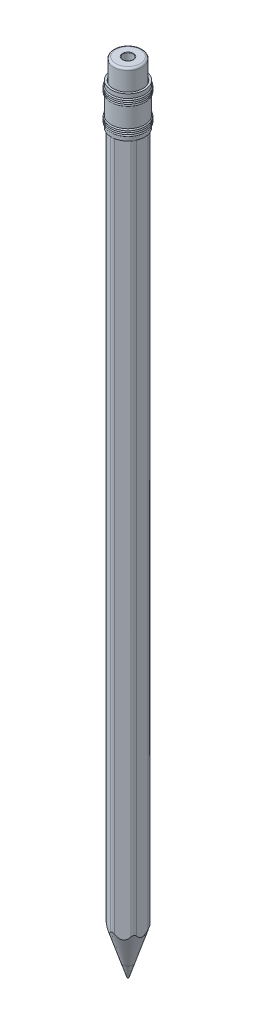
from build123d import *

# Parameters (mm, degrees)
SKETCH1_R           = 1.25
LEAD_DEPTH          = 185
WOODEN_CASING_DEPTH = 185
SKETCH2_4_R         = 1.25
CUT_EXTRUDE6_DEPTH  = 185
SKETCH3_R           = 3.5
ERASER_DEPTH        = 10
FILLET1_R           = 0.5
FILLET2_R           = 1
SKETCH5_W           = 2.170940171
SKETCH5_H           = 0.189957265
SKETCH5_W_2         = 1.546794872
NAME_LABEL_DEPTH    = 0.1
CUT_EXTRUDE4_START  = -2
SKETCH7_R           = 1.25
CUT_EXTRUDE4_DEPTH  = 2
FILLET3_R           = 0.1


with BuildPart() as part:
    # Sketch1 → Lead (new body)
    with BuildSketch(Plane(origin=(0, 0, 0), x_dir=(1, 0, 0), z_dir=(0, 1, 0))):
        with Locations(Location((0, 0, 0), (0, 0, 270))):
            Circle(SKETCH1_R)
    extrude(amount=LEAD_DEPTH)


with BuildPart() as body_2:
    # Sketch2 → Wooden Casing (new body)
    with BuildSketch(Plane(origin=(0, 0, 0), x_dir=(1, 0, 0), z_dir=(0, 1, 0))):
        Polygon((3.5, -2.020725942), (3.5, 2.020725942), (0, 4.041451884), (-3.5, 2.020725942), (-3.5, -2.020725942), (0, -4.041451884), align=None)
    extrude(amount=WOODEN_CASING_DEPTH)

    # Sketch2<4> → Cut-Extrude6 (cut)
    with BuildSketch(Plane(origin=(0, 0, 0), x_dir=(1, 0, 0), z_dir=(0, 1, 0))):
        with Locations(Location((0, 0, 0), (0, 0, 270))):
            Circle(SKETCH2_4_R)
    extrude(amount=CUT_EXTRUDE6_DEPTH, mode=Mode.SUBTRACT)

    # Fillet2
    fillet2_edges = [body_2.edges().sort_by_distance(p)[0] for p in [
        (3.5, 92.5, -2.020725942),
        (0, 92.5, -4.041451884),
        (-3.5, 92.5, -2.020725942),
        (-3.5, 92.5, 2.020725942),
        (0, 92.5, 4.041451884),
        (3.5, 92.5, 2.020725942),
    ]]
    fillet(fillet2_edges, radius=FILLET2_R)

    # Sketch5 → Name_Label (cut)
    # profile 1 of 9: a face of its own
    with BuildSketch(Plane(origin=(-1.75, 0, -3.031088913), x_dir=(-0.8660254037844386, 0, 0.5000000000000001), z_dir=(-0.5000000000000001, 0, -0.8660254037844386))):
        with BuildLine():
            Line((-1.173290994, 169.326265828), (-1.173290994, 169.739253275))
            add(Edge.make_bspline(
                [(-1.173290994, 169.739253275), (-1.17318638, 169.759469864), (-1.172983612, 169.798654645), (-1.169765835, 169.855630641), (-1.165488106, 169.909015169), (-1.158312444, 169.958713893), (-1.15087223, 170.005050195), (-1.139951776, 170.047553663), (-1.127889737, 170.086580317), (-1.109330654, 170.13344334), (-1.080508163, 170.186615862), (-1.037761669, 170.243766373), (-0.986512076, 170.293445085), (-0.928109122, 170.335686715), (-0.863859254, 170.369586522), (-0.795144829, 170.39380127), (-0.723121885, 170.409357747), (-0.673743498, 170.410937521), (-0.648788456, 170.411735914)],
                knots=[0, 0, 0, 0, 1.00128172, 1.940733171, 2.826250472, 3.653024905, 4.427672124, 5.149348099, 5.824709082, 6.450061444, 7.643590664, 8.808605388, 9.972104426, 11.165284501, 12.367876273, 13.557044126, 14.765369432, 16, 16, 16, 16], degree=3))
            add(Edge.make_bspline(
                [(-0.648788456, 170.411735914), (-0.625413891, 170.411070911), (-0.579480666, 170.409764118), (-0.512413876, 170.397420341), (-0.44863728, 170.377829002), (-0.388205461, 170.350752981), (-0.332243361, 170.315867044), (-0.280924337, 170.274068787), (-0.236187965, 170.223848516), (-0.211187221, 170.186203231), (-0.198487976, 170.167081133)],
                knots=[0, 0, 0, 0, 1.044641374, 2.052818814, 3.038628718, 4.023282556, 5.005660861, 5.98021751, 6.974042014, 8, 8, 8, 8], degree=3))
            add(Edge.make_bspline(
                [(-0.198487976, 170.167081133), (-0.189253296, 170.191124403), (-0.171585068, 170.237125134), (-0.140396688, 170.30046537), (-0.10635159, 170.354837993), (-0.06974703, 170.401305145), (-0.029709295, 170.440836663), (0.014086903, 170.475073244), (0.061605709, 170.504671435), (0.112672477, 170.529859292), (0.16685429, 170.549644667), (0.223489372, 170.564186643), (0.282360611, 170.572788538), (0.322311813, 170.573961969), (0.34255102, 170.574556426)],
                knots=[0, 0, 0, 0, 1.272586185, 2.434772614, 3.483318042, 4.437947805, 5.351807173, 6.25737843, 7.180033415, 8.1141739, 9.066731021, 10.025721652, 10.999834114, 12, 12, 12, 12], degree=3))
            add(Edge.make_bspline(
                [(0.34255102, 170.574556426), (0.363213927, 170.573965796), (0.403868775, 170.572803715), (0.463590917, 170.564226364), (0.520669704, 170.549713349), (0.575448027, 170.52968824), (0.627811035, 170.503732367), (0.677569036, 170.471688388), (0.72482555, 170.434006137), (0.769663978, 170.391419102), (0.81069255, 170.343959184), (0.845963285, 170.291655299), (0.876291091, 170.235940319), (0.900982909, 170.176101982), (0.92003263, 170.112293042), (0.933305046, 170.044549006), (0.942262985, 169.972981439), (0.942998484, 169.923868515), (0.943375673, 169.898681693)],
                knots=[0, 0, 0, 0, 0.978680899, 1.925582087, 2.851223405, 3.764209995, 4.683484765, 5.614004905, 6.562443559, 7.542772147, 8.539900013, 9.527881485, 10.525548727, 11.540192123, 12.58875426, 13.674701727, 14.807505862, 16, 16, 16, 16], degree=3))
            Line((0.943375673, 169.898681693), (0.943375673, 169.326265828))
            Line((0.943375673, 169.326265828), (-1.173290994, 169.326265828))
        make_face()
        with BuildLine():
            Line((-0.956196977, 169.516223093), (-0.277778173, 169.516223093))
            Line((-0.277778173, 169.516223093), (-0.277778173, 169.64385063))
            add(Edge.make_bspline(
                [(-0.277778173, 169.64385063), (-0.278020031, 169.662506807), (-0.278487351, 169.698554341), (-0.279826002, 169.750757326), (-0.283574341, 169.799213886), (-0.287321609, 169.84384037), (-0.293414319, 169.884566534), (-0.300666755, 169.921302042), (-0.308336709, 169.954623787), (-0.321381886, 169.993049184), (-0.340655044, 170.036642262), (-0.37059445, 170.083083883), (-0.406226123, 170.124216048), (-0.447724715, 170.158533324), (-0.492923978, 170.186867359), (-0.541427106, 170.206716242), (-0.592258036, 170.219948901), (-0.627220917, 170.221162485), (-0.644972351, 170.221778649)],
                knots=[0, 0, 0, 0, 1.156917035, 2.235399477, 3.236897345, 4.169954739, 5.01148057, 5.788325709, 6.491867502, 7.129259015, 8.302032419, 9.437271567, 10.542795419, 11.662606952, 12.764338259, 13.836858145, 14.901724648, 16, 16, 16, 16], degree=3))
            add(Edge.make_bspline(
                [(-0.644972351, 170.221778649), (-0.656721857, 170.221465799), (-0.679769797, 170.220852109), (-0.713477528, 170.215643402), (-0.745150432, 170.207203913), (-0.775092488, 170.19577457), (-0.802559565, 170.180160392), (-0.828864111, 170.162061508), (-0.852430611, 170.139715866), (-0.87439365, 170.114463307), (-0.894050496, 170.085569875), (-0.910333147, 170.052413061), (-0.925090639, 170.015850019), (-0.936015171, 169.974888774), (-0.945621584, 169.930378057), (-0.951657358, 169.881715175), (-0.955541435, 169.829208497), (-0.955973589, 169.792827964), (-0.956196977, 169.774022238)],
                knots=[0, 0, 0, 0, 0.911708768, 1.788416306, 2.640049961, 3.452993646, 4.268229297, 5.087074648, 5.92553149, 6.781184137, 7.681934069, 8.628939405, 9.643570426, 10.73771997, 11.914765019, 13.176320755, 14.540391495, 16, 16, 16, 16], degree=3))
            Line((-0.956196977, 169.774022238), (-0.956196977, 169.516223093))
        make_face(mode=Mode.SUBTRACT)
        with BuildLine():
            Line((-0.060684156, 169.516223093), (0.726281656, 169.516223093))
            Line((0.726281656, 169.516223093), (0.726281656, 169.786742591))
            add(Edge.make_bspline(
                [(0.726281656, 169.786742591), (0.726026504, 169.806104392), (0.725534732, 169.843421712), (0.724381425, 169.897343941), (0.72001864, 169.947191093), (0.71599399, 169.99312042), (0.709112012, 170.035010023), (0.702617214, 170.07318212), (0.692976151, 170.10701009), (0.679725643, 170.146596642), (0.658513226, 170.190845256), (0.627522083, 170.239201028), (0.58927423, 170.281366511), (0.54577454, 170.317561641), (0.498607602, 170.347431435), (0.448390033, 170.368865838), (0.396098469, 170.38218594), (0.360436102, 170.383793135), (0.34255102, 170.384599161)],
                knots=[0, 0, 0, 0, 1.160376723, 2.23647316, 3.230273494, 4.158083346, 4.997711197, 5.773399541, 6.476071462, 7.102777513, 8.27340052, 9.405620712, 10.53304798, 11.669441455, 12.787990954, 13.865552736, 14.929550474, 16, 16, 16, 16], degree=3))
            add(Edge.make_bspline(
                [(0.34255102, 170.384599161), (0.331366711, 170.384432695), (0.309178498, 170.384102448), (0.276575776, 170.379099288), (0.244978583, 170.371861301), (0.214255248, 170.362328663), (0.184922344, 170.34900255), (0.156867378, 170.332665851), (0.129525192, 170.313965597), (0.094511155, 170.285114643), (0.054670038, 170.242537994), (0.016144949, 170.182031825), (-0.015425989, 170.113614028), (-0.02877283, 170.063875301), (-0.035667463, 170.03818156)],
                knots=[0, 0, 0, 0, 0.723302347, 1.434937762, 2.129609326, 2.821140842, 3.513216847, 4.209993937, 4.920569932, 5.655069131, 7.14393391, 8.6716197, 10.280644748, 12, 12, 12, 12], degree=3))
            add(Edge.make_bspline(
                [(-0.035667463, 170.03818156), (-0.037756966, 170.027883011), (-0.04228744, 170.005553634), (-0.047069717, 169.969142383), (-0.051330301, 169.927573548), (-0.054481811, 169.880751141), (-0.057739387, 169.828615923), (-0.059006255, 169.771056549), (-0.060517713, 169.708308077), (-0.060627256, 169.664769833), (-0.060684156, 169.642154583)],
                knots=[0, 0, 0, 0, 0.634451884, 1.375622551, 2.216452059, 3.157844607, 4.20941857, 5.370758133, 6.634282058, 8, 8, 8, 8], degree=3))
            Line((-0.060684156, 169.642154583), (-0.060684156, 169.516223093))
        make_face(mode=Mode.SUBTRACT)
    # profile 2 of 9: a face of its own
    with BuildSketch(Plane(origin=(-1.75, 0, -3.031088913), x_dir=(-0.8660254037844386, 0, 0.5000000000000001), z_dir=(-0.5000000000000001, 0, -0.8660254037844386))):
        Polygon((-1.173290994, 167.31814617), (-1.173290994, 167.508103435), (-0.304914925, 167.508103435), (-0.304914925, 168.59357352), (-1.173290994, 168.59357352), (-1.173290994, 168.783530785), (0.943375673, 168.783530785), (0.943375673, 168.59357352), (-0.087820908, 168.59357352), (-0.087820908, 167.508103435), (0.943375673, 167.508103435), (0.943375673, 167.31814617), align=None)
    # profile 3 of 9: a face of its own
    with BuildSketch(Plane(origin=(-1.75, 0, -3.031088913), x_dir=(-0.8660254037844386, 0, 0.5000000000000001), z_dir=(-0.5000000000000001, 0, -0.8660254037844386))):
        with Locations((-0.142094412, 165.920603435)):
            Rectangle(SKETCH5_W, SKETCH5_H)
    # profile 4 of 9: a face of its own
    with BuildSketch(Plane(origin=(-1.75, 0, -3.031088913), x_dir=(-0.8660254037844386, 0, 0.5000000000000001), z_dir=(-0.5000000000000001, 0, -0.8660254037844386))):
        with BuildLine():
            add(Edge.make_bspline(
                [(-1.25470125, 165.322746864), (-1.254154453, 165.33453447), (-1.25308372, 165.357616865), (-1.243914636, 165.39099565), (-1.228372445, 165.421389177), (-1.207520448, 165.448348091), (-1.182997689, 165.471481375), (-1.154416056, 165.487677329), (-1.123537736, 165.49808673), (-1.101999087, 165.499343761), (-1.091032714, 165.499983777)],
                knots=[0, 0, 0, 0, 1.055194115, 2.066272739, 3.074728998, 4.095836921, 5.109056067, 6.073838105, 7.019297344, 8, 8, 8, 8], degree=3))
            add(Edge.make_bspline(
                [(-1.091032714, 165.499983777), (-1.080351014, 165.499329328), (-1.059234558, 165.498035559), (-1.028891553, 165.487685369), (-1.000707058, 165.471343349), (-0.976231914, 165.448362925), (-0.955391444, 165.421385246), (-0.939846197, 165.390996695), (-0.930677924, 165.35761659), (-0.929607078, 165.334534377), (-0.929060224, 165.322746864)],
                knots=[0, 0, 0, 0, 0.96129708, 1.900370562, 2.859976407, 3.87933698, 4.906634145, 5.921202961, 6.938410037, 8, 8, 8, 8], degree=3))
            add(Edge.make_bspline(
                [(-0.929060224, 165.322746864), (-0.929586198, 165.311094146), (-0.930609937, 165.288413651), (-0.940026091, 165.255534656), (-0.955396763, 165.225400284), (-0.976095456, 165.198388791), (-1.00085737, 165.175873389), (-1.028874353, 165.159485354), (-1.059238937, 165.149159067), (-1.080352485, 165.147862078), (-1.091032714, 165.147205999)],
                knots=[0, 0, 0, 0, 1.054934014, 2.053291228, 3.073705704, 4.106921865, 5.123545215, 6.088680038, 7.033164197, 8, 8, 8, 8], degree=3))
            add(Edge.make_bspline(
                [(-1.091032714, 165.147205999), (-1.101997561, 165.147847704), (-1.123533213, 165.149108052), (-1.154433542, 165.159493094), (-1.182846164, 165.175736883), (-1.207656824, 165.1984037), (-1.228367158, 165.225396316), (-1.243734752, 165.255535681), (-1.253151704, 165.28841338), (-1.254175333, 165.311094054), (-1.25470125, 165.322746864)],
                knots=[0, 0, 0, 0, 0.98631895, 1.937192651, 2.907499808, 3.917963147, 4.944918757, 5.95915025, 6.951458133, 8, 8, 8, 8], degree=3))
        make_face()
    # profile 5 of 9: a face of its own
    with BuildSketch(Plane(origin=(-1.75, 0, -3.031088913), x_dir=(-0.8660254037844386, 0, 0.5000000000000001), z_dir=(-0.5000000000000001, 0, -0.8660254037844386))):
        with Locations((0.169978237, 165.323594888)):
            Rectangle(SKETCH5_W_2, SKETCH5_H)
    # profile 6 of 9: a face of its own
    with BuildSketch(Plane(origin=(-1.75, 0, -3.031088913), x_dir=(-0.8660254037844386, 0, 0.5000000000000001), z_dir=(-0.5000000000000001, 0, -0.8660254037844386))):
        with BuildLine():
            Line((-0.268025903, 164.875838478), (-0.169231165, 164.716834071))
            add(Edge.make_bspline(
                [(-0.169231165, 164.716834071), (-0.190898812, 164.699398866), (-0.233547898, 164.665080627), (-0.288587239, 164.605487851), (-0.335859688, 164.541980948), (-0.37438529, 164.4734747), (-0.404152548, 164.400065192), (-0.425216529, 164.322041925), (-0.438342428, 164.239416024), (-0.439834277, 164.18277088), (-0.440598686, 164.153746464)],
                knots=[0, 0, 0, 0, 1.026593902, 2.0206758, 2.988051866, 3.946915611, 4.916868779, 5.907761954, 6.927957743, 8, 8, 8, 8], degree=3))
            add(Edge.make_bspline(
                [(-0.440598686, 164.153746464), (-0.439959548, 164.130548428), (-0.438700783, 164.084860527), (-0.430832533, 164.01778871), (-0.416534747, 163.95390024), (-0.397695835, 163.892794668), (-0.37244685, 163.834906606), (-0.341719045, 163.780084383), (-0.30600783, 163.72784173), (-0.264635738, 163.679692558), (-0.219642258, 163.635648349), (-0.171410262, 163.597488529), (-0.121384423, 163.564264765), (-0.068315512, 163.538195925), (-0.013417613, 163.516862845), (0.044345528, 163.502828305), (0.104233895, 163.493475846), (0.145066414, 163.492405824), (0.16573812, 163.491864119)],
                knots=[0, 0, 0, 0, 1.112346261, 2.190735716, 3.231507886, 4.247384806, 5.251966152, 6.253067467, 7.256802811, 8.280671706, 9.291813951, 10.270744147, 11.225547591, 12.165006084, 13.100104208, 14.043489273, 15.009504848, 16, 16, 16, 16], degree=3))
            add(Edge.make_bspline(
                [(0.16573812, 163.491864119), (0.192808964, 163.492956451), (0.246724424, 163.495131986), (0.326175482, 163.511678619), (0.402849842, 163.539365495), (0.47633299, 163.57676918), (0.54441973, 163.62424699), (0.605492244, 163.679984719), (0.658357708, 163.744041809), (0.702186446, 163.815846252), (0.73742067, 163.893714126), (0.762522733, 163.976802401), (0.777673451, 164.064432275), (0.779582045, 164.124428736), (0.78055516, 164.155018499)],
                knots=[0, 0, 0, 0, 0.96628757, 1.924499989, 2.884001032, 3.87047137, 4.860396324, 5.839257425, 6.814467993, 7.816059692, 8.834901047, 9.858382822, 10.908076205, 12, 12, 12, 12], degree=3))
            add(Edge.make_bspline(
                [(0.78055516, 164.155018499), (0.779769274, 164.183052349), (0.778224798, 164.238146302), (0.765204902, 164.318680803), (0.743890895, 164.395352464), (0.714168268, 164.468158558), (0.675749247, 164.536966049), (0.628360605, 164.60133036), (0.573365614, 164.662532227), (0.530839983, 164.698513732), (0.509187639, 164.716834071)],
                knots=[0, 0, 0, 0, 1.039848629, 2.043578496, 3.018386758, 3.987534228, 4.954977003, 5.934852016, 6.948509513, 8, 8, 8, 8], degree=3))
            Line((0.509187639, 164.716834071), (0.61349453, 164.875838478))
            add(Edge.make_bspline(
                [(0.61349453, 164.875838478), (0.627337969, 164.866411629), (0.654978901, 164.847589221), (0.693952247, 164.816124895), (0.730432503, 164.782185759), (0.764370767, 164.745904219), (0.796579188, 164.707754018), (0.825517998, 164.666431901), (0.852813819, 164.623270279), (0.877374937, 164.577762455), (0.89945257, 164.530378938), (0.918436754, 164.481186401), (0.934747246, 164.43039861), (0.947711737, 164.377955849), (0.95805972, 164.32375473), (0.964926007, 164.267935427), (0.970051534, 164.210517166), (0.970357463, 164.171708293), (0.970512425, 164.152050417)],
                knots=[0, 0, 0, 0, 0.954134338, 1.905101784, 2.851144739, 3.791306361, 4.734911809, 5.6936923, 6.663572882, 7.643865596, 8.638447847, 9.640600242, 10.646758161, 11.676244097, 12.717260333, 13.78922464, 14.880174919, 16, 16, 16, 16], degree=3))
            add(Edge.make_bspline(
                [(0.970512425, 164.152050417), (0.969972518, 164.122048037), (0.968914295, 164.063243154), (0.957310374, 163.977166386), (0.939752034, 163.89493061), (0.914764782, 163.816391309), (0.881766248, 163.742028643), (0.842381322, 163.671223539), (0.795308446, 163.60470666), (0.741665914, 163.542914069), (0.683445631, 163.486404764), (0.620984012, 163.437232782), (0.555661275, 163.395561063), (0.487065678, 163.361233263), (0.415478492, 163.334392126), (0.340462387, 163.315912959), (0.262653836, 163.303989573), (0.209596959, 163.302607518), (0.18269859, 163.301906854)],
                knots=[0, 0, 0, 0, 1.113096611, 2.181677437, 3.217994567, 4.231807234, 5.234933164, 6.233258928, 7.234764453, 8.254006763, 9.267004511, 10.242118657, 11.199842941, 12.138404996, 13.084707599, 14.031460992, 15.002005182, 16, 16, 16, 16], degree=3))
            add(Edge.make_bspline(
                [(0.18269859, 163.301906854), (0.164447822, 163.302173563), (0.128144033, 163.302704093), (0.074262731, 163.308789164), (0.021098992, 163.316650145), (-0.030673296, 163.329970472), (-0.081839352, 163.345355997), (-0.131782466, 163.364995961), (-0.18073472, 163.388034605), (-0.228570014, 163.414191735), (-0.274501402, 163.443636833), (-0.317895285, 163.47622215), (-0.359272953, 163.510720392), (-0.397205894, 163.548745469), (-0.433211114, 163.588683736), (-0.466326742, 163.631665117), (-0.496650103, 163.677443085), (-0.524741908, 163.725330142), (-0.549754518, 163.775298419), (-0.571304143, 163.827045882), (-0.589720701, 163.880260714), (-0.604300857, 163.935028039), (-0.616527584, 163.990984344), (-0.624218853, 164.048570582), (-0.629653409, 164.107566449), (-0.630252602, 164.147514616), (-0.630555951, 164.167738852)],
                knots=[0, 0, 0, 0, 0.990994727, 1.971252077, 2.943264845, 3.907940874, 4.872158414, 5.844625996, 6.82015047, 7.809835459, 8.804511986, 9.781214284, 10.756496977, 11.728388426, 12.696359165, 13.676225489, 14.672885716, 15.677705647, 16.690706858, 17.706033469, 18.721040654, 19.747369689, 20.783475414, 21.830280724, 22.901553713, 24, 24, 24, 24], degree=3))
            add(Edge.make_bspline(
                [(-0.630555951, 164.167738852), (-0.629998484, 164.193066377), (-0.628886337, 164.243594829), (-0.61952458, 164.318548979), (-0.605414829, 164.392401355), (-0.584494532, 164.463845696), (-0.559219998, 164.53205395), (-0.530666918, 164.595732687), (-0.498212122, 164.653920229), (-0.462054308, 164.707129825), (-0.420864787, 164.75534673), (-0.375062815, 164.799806758), (-0.32431871, 164.840802839), (-0.286945032, 164.864063549), (-0.268025903, 164.875838478)],
                knots=[0, 0, 0, 0, 1.095139042, 2.184804066, 3.262657822, 4.34424993, 5.400369085, 6.407210964, 7.359649996, 8.278719237, 9.185177137, 10.097389079, 11.036869154, 12, 12, 12, 12], degree=3))
        make_face()
    # profile 7 of 9: a face of its own
    with BuildSketch(Plane(origin=(-1.75, 0, -3.031088913), x_dir=(-0.8660254037844386, 0, 0.5000000000000001), z_dir=(-0.5000000000000001, 0, -0.8660254037844386))):
        with BuildLine():
            Line((-0.603419199, 161.565154717), (-0.603419199, 161.755111982))
            Line((-0.603419199, 161.755111982), (-0.324419466, 161.755111982))
            add(Edge.make_bspline(
                [(-0.324419466, 161.755111982), (-0.349762188, 161.775359254), (-0.398863381, 161.81458808), (-0.46289085, 161.88058976), (-0.516620138, 161.949409876), (-0.558924228, 162.022166174), (-0.590918916, 162.098109976), (-0.613990856, 162.177025794), (-0.627833243, 162.259340761), (-0.629641277, 162.315320482), (-0.630555951, 162.343640294)],
                knots=[0, 0, 0, 0, 1.127869841, 2.185233117, 3.191641716, 4.159226741, 5.10472073, 6.052603964, 7.014823782, 8, 8, 8, 8], degree=3))
            add(Edge.make_bspline(
                [(-0.630555951, 162.343640294), (-0.629561726, 162.372278498), (-0.627614813, 162.428358468), (-0.610410434, 162.509703554), (-0.583343217, 162.586142264), (-0.54491073, 162.656547904), (-0.497448, 162.720165207), (-0.442070067, 162.775836747), (-0.378706573, 162.822259164), (-0.31957811, 162.8532884), (-0.267033951, 162.873339725), (-0.222095045, 162.886519605), (-0.172006279, 162.897181554), (-0.116892771, 162.906735358), (-0.056532768, 162.913108724), (0.008929549, 162.918160825), (0.079482882, 162.921774446), (0.128279006, 162.921918196), (0.153441779, 162.921992324)],
                knots=[0, 0, 0, 0, 1.235846195, 2.420061613, 3.574938557, 4.72781258, 5.870749808, 6.993217613, 8.10690044, 9.251157787, 9.865716151, 10.534141144, 11.271861846, 12.076851687, 12.949307443, 13.892392281, 14.913166647, 16, 16, 16, 16], degree=3))
            Line((0.153441779, 162.921992324), (0.943375673, 162.921992324))
            Line((0.943375673, 162.921992324), (0.943375673, 162.732035059))
            Line((0.943375673, 162.732035059), (0.215771506, 162.732035059))
            add(Edge.make_bspline(
                [(0.215771506, 162.732035059), (0.194712188, 162.731918698), (0.154429296, 162.731696118), (0.096754136, 162.730984904), (0.044590127, 162.72931074), (-0.002212648, 162.72686151), (-0.043482886, 162.723433207), (-0.07942949, 162.719763146), (-0.109734052, 162.715311902), (-0.127976721, 162.7113426), (-0.136158248, 162.709562436)],
                knots=[0, 0, 0, 0, 1.430803381, 2.736883362, 3.918614142, 4.976458302, 5.92063272, 6.731858525, 7.431260095, 8, 8, 8, 8], degree=3))
            add(Edge.make_bspline(
                [(-0.136158248, 162.709562436), (-0.160191313, 162.703168416), (-0.206324508, 162.690894637), (-0.268793601, 162.65994896), (-0.322409558, 162.621777799), (-0.366069699, 162.574484605), (-0.400057995, 162.519339558), (-0.423622777, 162.456250983), (-0.438366118, 162.385871815), (-0.439833737, 162.336369083), (-0.440598686, 162.310567377)],
                knots=[0, 0, 0, 0, 1.084232, 2.08126119, 3.027460722, 3.945137793, 4.874029258, 5.839697328, 6.874011781, 8, 8, 8, 8], degree=3))
            add(Edge.make_bspline(
                [(-0.440598686, 162.310567377), (-0.440314957, 162.295285087), (-0.439753466, 162.265041828), (-0.4339773, 162.220218554), (-0.424846158, 162.176606623), (-0.411389424, 162.134305322), (-0.394872474, 162.093177361), (-0.375002014, 162.052934071), (-0.350540889, 162.01450415), (-0.323194572, 161.977255213), (-0.292913078, 161.942592876), (-0.260953566, 161.910342378), (-0.226920529, 161.881593077), (-0.191360481, 161.855546813), (-0.153785533, 161.833062808), (-0.114558066, 161.813436419), (-0.073626482, 161.796783879), (-0.045217755, 161.788509108), (-0.031003333, 161.784368793)],
                knots=[0, 0, 0, 0, 1.023827899, 2.026128959, 3.023898047, 4.006668367, 4.997079741, 5.992687789, 7.009920206, 8.046337072, 9.087246971, 10.092051999, 11.086713115, 12.070168086, 13.043348831, 14.017773728, 15.008185103, 16, 16, 16, 16], degree=3))
            add(Edge.make_bspline(
                [(-0.031003333, 161.784368793), (-0.020568044, 161.781986243), (0.002149035, 161.776799558), (0.039429232, 161.77119754), (0.082554788, 161.766112958), (0.13147538, 161.761857274), (0.186362285, 161.759253522), (0.246981101, 161.75641453), (0.313573544, 161.755380955), (0.359935616, 161.75520415), (0.384104172, 161.755111982)],
                knots=[0, 0, 0, 0, 0.615963638, 1.340920617, 2.168419149, 3.115676021, 4.16674242, 5.331190069, 6.6087489, 8, 8, 8, 8], degree=3))
            Line((0.384104172, 161.755111982), (0.943375673, 161.755111982))
            Line((0.943375673, 161.755111982), (0.943375673, 161.565154717))
            Line((0.943375673, 161.565154717), (-0.603419199, 161.565154717))
        make_face()
    # profile 8 of 9: a face of its own
    with BuildSketch(Plane(origin=(-1.75, 0, -3.031088913), x_dir=(-0.8660254037844386, 0, 0.5000000000000001), z_dir=(-0.5000000000000001, 0, -0.8660254037844386))):
        with BuildLine():
            Line((0.454914135, 160.935073253), (0.543532591, 161.103829931))
            add(Edge.make_bspline(
                [(0.543532591, 161.103829931), (0.56738076, 161.09037503), (0.613779854, 161.064197121), (0.677530207, 161.019361935), (0.734539621, 160.971931386), (0.783895211, 160.920462351), (0.827482326, 160.86650581), (0.86507865, 160.809036961), (0.897362557, 160.748524887), (0.923816206, 160.684303077), (0.944612927, 160.616448463), (0.959971447, 160.544567304), (0.96887793, 160.468320203), (0.969958909, 160.416106293), (0.970512425, 160.389370128)],
                knots=[0, 0, 0, 0, 1.120611642, 2.180266485, 3.186550691, 4.152466804, 5.095166165, 6.022949561, 6.960161436, 7.899497276, 8.862391909, 9.862399089, 10.905440174, 12, 12, 12, 12], degree=3))
            add(Edge.make_bspline(
                [(0.970512425, 160.389370128), (0.969818657, 160.359650932), (0.968465317, 160.301677391), (0.95679797, 160.217289067), (0.937764685, 160.137835802), (0.911176004, 160.063322049), (0.876446133, 159.993930338), (0.834137352, 159.929522559), (0.784466711, 159.869760723), (0.727005075, 159.816525332), (0.665509145, 159.768607968), (0.6014403, 159.72629666), (0.535020419, 159.691087586), (0.466644684, 159.662009437), (0.396468473, 159.639072287), (0.324089878, 159.622772795), (0.249795901, 159.613463605), (0.199542843, 159.612030674), (0.174218355, 159.611308563)],
                knots=[0, 0, 0, 0, 1.14524686, 2.234044844, 3.276713788, 4.290115724, 5.276966211, 6.260758605, 7.254862358, 8.264742877, 9.274005885, 10.257798278, 11.220590477, 12.167824544, 13.118936889, 14.062732937, 15.023735098, 16, 16, 16, 16], degree=3))
            add(Edge.make_bspline(
                [(0.174218355, 159.611308563), (0.150454338, 159.611949091), (0.103357196, 159.613218534), (0.033648985, 159.62122001), (-0.034101555, 159.635400645), (-0.099950721, 159.65485966), (-0.163788259, 159.67998827), (-0.225653022, 159.71072966), (-0.285479178, 159.747131717), (-0.323218216, 159.77523662), (-0.34222796, 159.789393499)],
                knots=[0, 0, 0, 0, 1.024358464, 2.0301432, 3.019427413, 4.004406732, 4.986367066, 5.972626655, 6.978780325, 8, 8, 8, 8], degree=3))
            add(Edge.make_bspline(
                [(-0.34222796, 159.789393499), (-0.365167582, 159.808536039), (-0.410246472, 159.846153244), (-0.468938508, 159.910437475), (-0.519144528, 159.979108056), (-0.560102698, 160.052855731), (-0.591606006, 160.131556276), (-0.614013893, 160.214803759), (-0.627957104, 160.302828274), (-0.629676498, 160.363170043), (-0.630555951, 160.394034258)],
                knots=[0, 0, 0, 0, 1.030811313, 2.025658015, 2.997072178, 3.962767568, 4.930766827, 5.917075773, 6.934604948, 8, 8, 8, 8], degree=3))
            add(Edge.make_bspline(
                [(-0.630555951, 160.394034258), (-0.629741175, 160.425754395), (-0.62814277, 160.487982074), (-0.613191755, 160.578690017), (-0.589770091, 160.664688312), (-0.555645838, 160.745267261), (-0.513346496, 160.821668466), (-0.459882109, 160.892133562), (-0.39799867, 160.958596862), (-0.350358063, 160.997242288), (-0.326115513, 161.016907521)],
                knots=[0, 0, 0, 0, 1.056389096, 2.072394598, 3.055233004, 4.020130009, 4.981825462, 5.957811105, 6.960805292, 8, 8, 8, 8], degree=3))
            add(Edge.make_bspline(
                [(-0.326115513, 161.016907521), (-0.307849538, 161.030289051), (-0.27143917, 161.056963038), (-0.212068995, 161.09037438), (-0.14995354, 161.119377185), (-0.084088741, 161.1425595), (-0.015254995, 161.161331007), (0.057039782, 161.174912036), (0.132774062, 161.18287652), (0.184376312, 161.184442065), (0.210683365, 161.185240187)],
                knots=[0, 0, 0, 0, 0.94817472, 1.890038105, 2.849395472, 3.817997239, 4.812318967, 5.836947057, 6.897266129, 8, 8, 8, 8], degree=3))
            Line((0.210683365, 161.185240187), (0.210683365, 159.801265828))
            add(Edge.make_bspline(
                [(0.210683365, 159.801265828), (0.231064122, 159.802196923), (0.271142059, 159.804027885), (0.329786294, 159.812564186), (0.385650173, 159.826019396), (0.438314679, 159.844929734), (0.488467661, 159.86783016), (0.535737083, 159.895882474), (0.579907641, 159.929349728), (0.621374434, 159.96667908), (0.658301656, 160.008230514), (0.691352968, 160.051944366), (0.719054448, 160.098446664), (0.741539429, 160.147370743), (0.75914182, 160.19863749), (0.771157121, 160.252263055), (0.779204753, 160.308141916), (0.780099598, 160.346233289), (0.78055516, 160.36562547)],
                knots=[0, 0, 0, 0, 1.094153842, 2.151609401, 3.174256925, 4.172055639, 5.149267565, 6.128595816, 7.11444997, 8.118368179, 9.117203808, 10.09244225, 11.054858984, 12.015122123, 12.976791628, 13.957293641, 14.960065497, 16, 16, 16, 16], degree=3))
            add(Edge.make_bspline(
                [(0.78055516, 160.36562547), (0.780190392, 160.384586277), (0.779466622, 160.422208156), (0.772327988, 160.478221631), (0.761013874, 160.533424793), (0.744718108, 160.587269491), (0.725635985, 160.638971006), (0.703176451, 160.687113935), (0.677570039, 160.731061805), (0.64847156, 160.772297094), (0.612760083, 160.812076763), (0.568623819, 160.85216311), (0.515562174, 160.894197524), (0.475890895, 160.920935279), (0.454914135, 160.935073253)],
                knots=[0, 0, 0, 0, 0.991168677, 1.966668791, 2.94808785, 3.9350306, 4.905702032, 5.828266021, 6.709360349, 7.562606342, 8.463112863, 9.498839253, 10.677475166, 12, 12, 12, 12], degree=3))
        make_face()
        with BuildLine():
            add(Edge.make_bspline(
                [(0.0207261, 160.995282922), (-0.00448261, 160.988358357), (-0.052875143, 160.975065442), (-0.119863688, 160.946755869), (-0.179742238, 160.915642049), (-0.231515746, 160.878187132), (-0.277571164, 160.836164151), (-0.317174949, 160.786954225), (-0.353676999, 160.732691645), (-0.384074516, 160.672295608), (-0.409053959, 160.608147835), (-0.427421571, 160.541566815), (-0.438218603, 160.473110224), (-0.439801596, 160.427003051), (-0.440598686, 160.403786528)],
                knots=[0, 0, 0, 0, 1.155085888, 2.217389643, 3.210301801, 4.133263417, 5.03575695, 5.95948047, 6.920061569, 7.923798377, 8.943125483, 9.960783337, 10.973185325, 12, 12, 12, 12], degree=3))
            add(Edge.make_bspline(
                [(-0.440598686, 160.403786528), (-0.440233084, 160.384826133), (-0.439510366, 160.347345418), (-0.432511344, 160.292150943), (-0.421264693, 160.239007289), (-0.404728225, 160.188073089), (-0.384606612, 160.139010477), (-0.359873078, 160.091854905), (-0.329969802, 160.047212566), (-0.307126846, 160.019311167), (-0.295586667, 160.005215481)],
                knots=[0, 0, 0, 0, 1.048823158, 2.073302879, 3.073550078, 4.050623576, 5.03253758, 6.005186856, 6.992227572, 8, 8, 8, 8], degree=3))
            add(Edge.make_bspline(
                [(-0.295586667, 160.005215481), (-0.286459159, 159.995118438), (-0.267987308, 159.974684483), (-0.236144194, 159.94740991), (-0.201787338, 159.921100717), (-0.163417032, 159.897721166), (-0.122145973, 159.875502373), (-0.077673017, 159.855255291), (-0.029810442, 159.836845708), (0.003558332, 159.826511293), (0.0207261, 159.82119438)],
                knots=[0, 0, 0, 0, 0.879905587, 1.780714457, 2.708106151, 3.677566983, 4.684151534, 5.740052498, 6.837288539, 8, 8, 8, 8], degree=3))
            Line((0.0207261, 159.82119438), (0.0207261, 160.995282922))
        make_face(mode=Mode.SUBTRACT)
    # profile 9 of 9: a face of its own
    with BuildSketch(Plane(origin=(-1.75, 0, -3.031088913), x_dir=(-0.8660254037844386, 0, 0.5000000000000001), z_dir=(-0.5000000000000001, 0, -0.8660254037844386))):
        with BuildLine():
            Line((-1.173290994, 157.983103435), (-1.173290994, 158.39821094))
            add(Edge.make_bspline(
                [(-1.173290994, 158.39821094), (-1.173259609, 158.426762298), (-1.173199474, 158.481467967), (-1.171376271, 158.559914691), (-1.168941081, 158.631161529), (-1.165565364, 158.695054854), (-1.161575998, 158.751791256), (-1.155980717, 158.801114004), (-1.150138538, 158.843410784), (-1.144198926, 158.868754208), (-1.141490112, 158.880312302)],
                knots=[0, 0, 0, 0, 1.415646017, 2.712440637, 3.8905458, 4.950247383, 5.884950622, 6.709939814, 7.411656543, 8, 8, 8, 8], degree=3))
            add(Edge.make_bspline(
                [(-1.141490112, 158.880312302), (-1.137485253, 158.894943502), (-1.129569903, 158.923861136), (-1.113719109, 158.965531709), (-1.094913383, 159.005169323), (-1.073521448, 159.042950892), (-1.048490297, 159.078188284), (-1.021485144, 159.112056158), (-0.990760802, 159.143358979), (-0.957286326, 159.172520742), (-0.921486277, 159.199474149), (-0.882710212, 159.222119886), (-0.842115809, 159.241920612), (-0.799151355, 159.258132471), (-0.753775139, 159.270188284), (-0.706309631, 159.27913851), (-0.656701459, 159.284845504), (-0.622798131, 159.285390236), (-0.605539258, 159.285667537)],
                knots=[0, 0, 0, 0, 0.999549623, 1.97554611, 2.93413192, 3.889860808, 4.833293765, 5.780583482, 6.742559327, 7.719844669, 8.705620613, 9.691528643, 10.674968152, 11.680406189, 12.713313868, 13.765869198, 14.862690416, 16, 16, 16, 16], degree=3))
            add(Edge.make_bspline(
                [(-0.605539258, 159.285667537), (-0.588135554, 159.285412676), (-0.554084034, 159.284914022), (-0.50426811, 159.278929126), (-0.456662226, 159.270867533), (-0.411371939, 159.258471697), (-0.368666211, 159.242236457), (-0.327892419, 159.223191263), (-0.289744236, 159.200220271), (-0.25408317, 159.17382554), (-0.220875747, 159.144463386), (-0.190362609, 159.112258037), (-0.162722366, 159.077339513), (-0.137893054, 159.039818785), (-0.116450447, 158.999330067), (-0.097244838, 158.956487431), (-0.081115197, 158.910918491), (-0.07263035, 158.879384685), (-0.068316368, 158.863351832)],
                knots=[0, 0, 0, 0, 1.121902311, 2.195077645, 3.232258892, 4.234102512, 5.217864754, 6.176164875, 7.132989551, 8.084763148, 9.034132444, 9.988522005, 10.94243251, 11.903244335, 12.886203696, 13.894208494, 14.929344452, 16, 16, 16, 16], degree=3))
            add(Edge.make_bspline(
                [(-0.068316368, 158.863351832), (-0.065498476, 158.850090865), (-0.059322903, 158.821028684), (-0.052381731, 158.773169182), (-0.046689212, 158.717418225), (-0.041376907, 158.653965502), (-0.03856205, 158.582663043), (-0.035256949, 158.503674383), (-0.033697452, 158.416732196), (-0.033598872, 158.356092731), (-0.033547404, 158.324432895)],
                knots=[0, 0, 0, 0, 0.601372724, 1.317943291, 2.144091499, 3.08771165, 4.142394186, 5.309582461, 6.595334295, 8, 8, 8, 8], degree=3))
            Line((-0.033547404, 158.324432895), (-0.033547404, 158.1730607))
            Line((-0.033547404, 158.1730607), (0.943375673, 158.1730607))
            Line((0.943375673, 158.1730607), (0.943375673, 157.983103435))
            Line((0.943375673, 157.983103435), (-1.173290994, 157.983103435))
        make_face()
        with BuildLine():
            Line((-0.956196977, 158.1730607), (-0.250641421, 158.1730607))
            Line((-0.250641421, 158.1730607), (-0.245977292, 158.543646971))
            add(Edge.make_bspline(
                [(-0.245977292, 158.543646971), (-0.245967328, 158.561741529), (-0.245948093, 158.5966727), (-0.24836639, 158.647130057), (-0.251120839, 158.693949988), (-0.255286784, 158.736956431), (-0.260747678, 158.776300286), (-0.267538846, 158.81164172), (-0.274921925, 158.84350932), (-0.287257219, 158.88016682), (-0.306224, 158.921371058), (-0.333834381, 158.966383544), (-0.369602311, 159.004235696), (-0.409705722, 159.036931036), (-0.454198966, 159.063387583), (-0.502054488, 159.082051621), (-0.552563314, 159.093544166), (-0.58710439, 159.094979475), (-0.604691234, 159.095710273)],
                knots=[0, 0, 0, 0, 1.160746174, 2.240796558, 3.240300023, 4.169675897, 5.012224395, 5.787635701, 6.478238024, 7.109103438, 8.265591281, 9.382545711, 10.479929969, 11.588830844, 12.694575677, 13.785760505, 14.872603606, 16, 16, 16, 16], degree=3))
            add(Edge.make_bspline(
                [(-0.604691234, 159.095710273), (-0.621708318, 159.094946664), (-0.655536176, 159.093428706), (-0.705114053, 159.082146462), (-0.752427091, 159.063187166), (-0.796562024, 159.036907906), (-0.836577191, 159.005006031), (-0.871397416, 158.967956424), (-0.899202202, 158.925664302), (-0.917839832, 158.886650819), (-0.928751506, 158.851714725), (-0.936632611, 158.821519078), (-0.942067176, 158.78725055), (-0.947267377, 158.749234745), (-0.951464977, 158.707519928), (-0.95437995, 158.66184097), (-0.95606803, 158.612349987), (-0.956152954, 158.577993279), (-0.956196977, 158.56018343)],
                knots=[0, 0, 0, 0, 1.120540835, 2.227496496, 3.330685923, 4.466139262, 5.598993257, 6.692710361, 7.80064471, 8.921224235, 9.527843361, 10.209888745, 10.975318552, 11.811557897, 12.738105936, 13.73658638, 14.826690375, 16, 16, 16, 16], degree=3))
            Line((-0.956196977, 158.56018343), (-0.956196977, 158.1730607))
        make_face(mode=Mode.SUBTRACT)
    extrude(amount=-NAME_LABEL_DEPTH, mode=Mode.SUBTRACT)


with BuildPart() as body_3:
    # Sketch3 → Eraser (new body)
    with BuildSketch(Plane(origin=(0, 185, 0), x_dir=(-1, 0, 0), z_dir=(0, 1, 0))):
        with Locations(Location((0, 0, 0), (0, 0, 90))):
            Circle(SKETCH3_R)
    extrude(amount=ERASER_DEPTH)

    # Fillet1
    fillet1_edges = [body_3.edges().sort_by_distance(p)[0] for p in [
        (0, 195, -3.5),
    ]]
    fillet(fillet1_edges, radius=FILLET1_R)

    # Sketch7 → Cut-Extrude4 (cut)
    with BuildSketch(Plane(origin=(0, 195, 0), x_dir=(1, 0, 0), z_dir=(0, 1, 0)).offset(CUT_EXTRUDE4_START)):
        with Locations(Location((0, 0, 0), (0, 0, 270))):
            Circle(SKETCH7_R)
    extrude(amount=CUT_EXTRUDE4_DEPTH, mode=Mode.SUBTRACT)

    # Fillet3
    fillet3_edges = [body_3.edges().sort_by_distance(p)[0] for p in [
        (0, 193, -1.25),
        (0, 195, -1.25),
    ]]
    fillet(fillet3_edges, radius=FILLET3_R)


with BuildPart() as body_4:
    # Sketch4 → Ferrule (revolve)
    with BuildSketch(Plane.XY):
        with BuildLine():
            Line((-4.1, 190), (-3.6, 190))
            Line((-3.6, 190), (-3.6, 189))
            ThreePointArc((-3.6, 189), (-3.4, 188.8), (-3.6, 188.6))
            ThreePointArc((-3.6, 188.6), (-3.4, 188.4), (-3.6, 188.2))
            ThreePointArc((-3.6, 188.2), (-3.4, 188), (-3.6, 187.8))
            ThreePointArc((-3.6, 187.8), (-3.4, 187.6), (-3.6, 187.4))
            Line((-3.6, 187.4), (-3.6, 182.6))
            ThreePointArc((-3.6, 182.6), (-3.4, 182.4), (-3.6, 182.2))
            ThreePointArc((-3.6, 182.2), (-3.4, 182), (-3.6, 181.8))
            ThreePointArc((-3.6, 181.8), (-3.4, 181.6), (-3.6, 181.4))
            ThreePointArc((-3.6, 181.4), (-3.4, 181.2), (-3.6, 181))
            Line((-3.6, 181), (-3.6, 180))
            Line((-3.6, 180), (-4.1, 180))
            Line((-4.1, 180), (-4.1, 181))
            ThreePointArc((-4.1, 181), (-4.3, 181.2), (-4.1, 181.4))
            ThreePointArc((-4.1, 181.4), (-4.3, 181.6), (-4.1, 181.8))
            ThreePointArc((-4.1, 181.8), (-4.3, 182), (-4.1, 182.2))
            ThreePointArc((-4.1, 182.2), (-4.3, 182.4), (-4.1, 182.6))
            Line((-4.1, 182.6), (-4.1, 187.4))
            ThreePointArc((-4.1, 187.4), (-4.3, 187.6), (-4.1, 187.8))
            ThreePointArc((-4.1, 187.8), (-4.3, 188), (-4.1, 188.2))
            ThreePointArc((-4.1, 188.2), (-4.3, 188.4), (-4.1, 188.6))
            ThreePointArc((-4.1, 188.6), (-4.3, 188.8), (-4.1, 189))
            Line((-4.1, 189), (-4.1, 190))
        make_face()
    revolve(axis=Axis((0, 195, 0), (0, -1, 0)))


with BuildPart() as cut_revolve1_tool:
    # Sketch6 → Cut-Revolve1 (revolve)
    with BuildSketch(Plane.XY):
        Polygon((-5, 15), (-0.2, 0), (-5, 0), align=None)
    revolve(axis=Axis((0, 43.761182523, 0), (0, -1, 0)))


with BuildPart() as part_1:
    add(part.part)

    # Cut-Revolve1: cut by cut_revolve1_tool
    add(cut_revolve1_tool.part, mode=Mode.SUBTRACT)


with BuildPart() as body_2_1:
    add(body_2.part)

    # Cut-Revolve1: cut by cut_revolve1_tool
    add(cut_revolve1_tool.part, mode=Mode.SUBTRACT)


solid = Compound([body_3.part, body_4.part, part_1.part, body_2_1.part])
